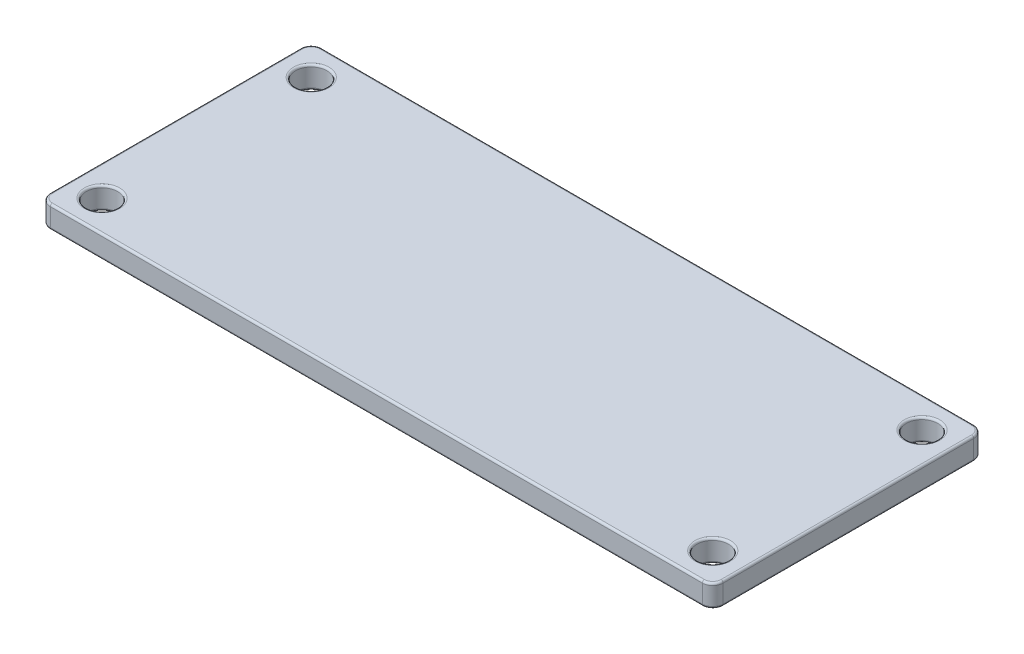
from build123d import *

# Parameters (mm, degrees)
SKETCH1_W           = 64.364
SKETCH1_H           = 25.959
BOSS_EXTRUDE1_DEPTH = 2.134
FILLET2_R           = 1
SKETCH2_R           = 1.5
CUT_EXTRUDE1_DEPTH  = 44.605714032
FILLET3_R           = 0.2


with BuildPart() as part:
    # Sketch1 → Boss-Extrude1 (new body)
    with BuildSketch(Plane(origin=(0, 0, 0), x_dir=(1, 0, 0), z_dir=(0, 1, 0))):
        with Locations((-7.318647975, 5.367247664)):
            Rectangle(SKETCH1_W, SKETCH1_H)
    extrude(amount=BOSS_EXTRUDE1_DEPTH)

    # Fillet2
    fillet2_edges = [part.edges().sort_by_distance(p)[0] for p in [
        (-39.500647975, 1.067, -18.346747664),
        (24.863352025, 1.067, -18.346747664),
        (24.863352025, 1.067, 7.612252336),
        (-39.500647975, 1.067, 7.612252336),
    ]]
    fillet(fillet2_edges, radius=FILLET2_R)

    # Sketch2 → Cut-Extrude1 (cut, through all)
    with BuildSketch(Plane.XZ):
        with Locations(Location((21.891352025, 4.640252336, 0), (0, 0, 270))):
            Circle(SKETCH2_R)
        with Locations(Location((21.891352025, -15.374747664, 0), (0, 0, 270))):
            Circle(SKETCH2_R)
        with Locations(Location((-36.528647975, -15.374747664, 0), (0, 0, 270))):
            Circle(SKETCH2_R)
        with Locations(Location((-36.528647975, 4.640252336, 0), (0, 0, 270))):
            Circle(SKETCH2_R)
    extrude(amount=-CUT_EXTRUDE1_DEPTH, mode=Mode.SUBTRACT)

    # Fillet3
    fillet3_edges = [part.edges().sort_by_distance(p)[0] for p in [
        (-39.500647975, 0, -5.367247664),
        (-39.500647975, 2.134, -5.367247664),
        (-7.318647975, 0, -18.346747664),
        (24.863352025, 0, -5.367247664),
        (-7.318647975, 0, 7.612252336),
        (24.570458806, 0, 7.319359118),
        (24.570458806, 0, -18.053854445),
        (-39.207754756, 0, 7.319359118),
        (-39.207754756, 0, -18.053854445),
        (-7.318647975, 2.134, -18.346747664),
        (-7.318647975, 2.134, 7.612252336),
        (24.863352025, 2.134, -5.367247664),
        (24.570458806, 2.134, 7.319359118),
        (24.570458806, 2.134, -18.053854445),
        (-39.207754756, 2.134, 7.319359118),
        (-39.207754756, 2.134, -18.053854445),
        (-36.528647975, 2.134, 6.140252336),
        (-36.528647975, 0, 6.140252336),
        (-36.528647975, 2.134, -13.874747664),
        (-36.528647975, 0, -13.874747664),
        (21.891352025, 2.134, -13.874747664),
        (21.891352025, 0, -13.874747664),
        (21.891352025, 2.134, 6.140252336),
        (21.891352025, 0, 6.140252336),
    ]]
    fillet(fillet3_edges, radius=FILLET3_R)


solid = part.part
